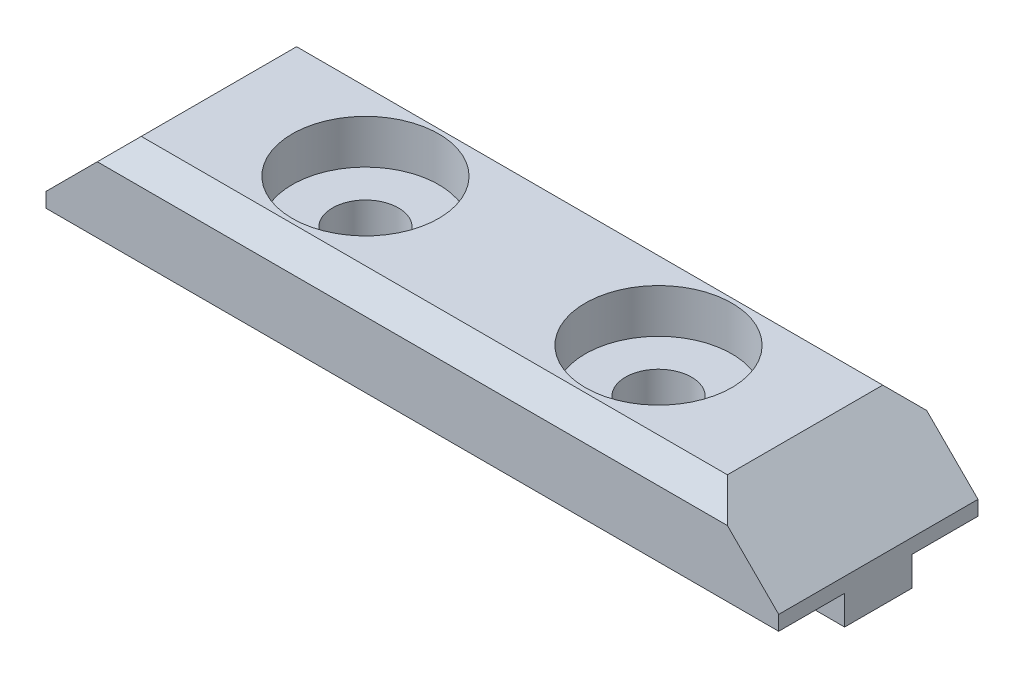
from build123d import *

# Parameters (mm, degrees)
ESTRUSIONE_ESTRUSIONE1_DEPTH                         = 50
SMUSSO1_SIZE                                         = 1.5
SMUSSO2_SIZE                                         = 5
FORO_LAMATO_PER_BULLONE_M5_A_TESTA_ESAGO_D           = 4.5
FORO_LAMATO_PER_BULLONE_M5_A_TESTA_ESAGO_DEPTH       = 70
FORO_LAMATO_PER_BULLONE_M5_A_TESTA_ESAGO_CBORE_D     = 10
FORO_LAMATO_PER_BULLONE_M5_A_TESTA_ESAGO_CBORE_DEPTH = 3
FORO_LAMATO_PER_BULLONE_M5_A_TESTA_ESAGO_TIP         = 1.351936393


with BuildPart() as part:
    # Schizzo1 → Estrusione-Estrusione1 (new body)
    with BuildSketch(Plane(origin=(0, 0, 0), x_dir=(0, 0, -1), z_dir=(1, 0, 0))):
        Polygon((-2.3, 0), (2.3, 0), (2.3, 2), (6.8, 2), (6.8, 8), (-6.8, 8), (-6.8, 2), (-2.3, 2), align=None)
    extrude(amount=ESTRUSIONE_ESTRUSIONE1_DEPTH)

    # Smusso1
    smusso1_edges = [part.edges().sort_by_distance(p)[0] for p in [
        (25, 8, 6.8),
        (25, 8, -6.8),
    ]]
    chamfer(smusso1_edges, length=SMUSSO1_SIZE)

    # Smusso2
    smusso2_edges = [part.edges().sort_by_distance(p)[0] for p in [
        (50, 8, 0),
        (0, 8, 0),
    ]]
    chamfer(smusso2_edges, length=SMUSSO2_SIZE)

    # Foro lamato per Bullone M5 a testa esagonale-1
    with Locations(Plane(origin=(0, 8, 0), x_dir=(1, 0, 0), z_dir=(0, 1, 0))):
        with Locations((15, 0), (35, 0)):
            CounterBoreHole(FORO_LAMATO_PER_BULLONE_M5_A_TESTA_ESAGO_D / 2, FORO_LAMATO_PER_BULLONE_M5_A_TESTA_ESAGO_CBORE_D / 2, FORO_LAMATO_PER_BULLONE_M5_A_TESTA_ESAGO_CBORE_DEPTH, depth=FORO_LAMATO_PER_BULLONE_M5_A_TESTA_ESAGO_DEPTH)
            with Locations((0, 0, -(FORO_LAMATO_PER_BULLONE_M5_A_TESTA_ESAGO_DEPTH + FORO_LAMATO_PER_BULLONE_M5_A_TESTA_ESAGO_TIP / 2))):  # 118° drill point
                Cone(0, FORO_LAMATO_PER_BULLONE_M5_A_TESTA_ESAGO_D / 2, FORO_LAMATO_PER_BULLONE_M5_A_TESTA_ESAGO_TIP, mode=Mode.SUBTRACT)


solid = part.part
